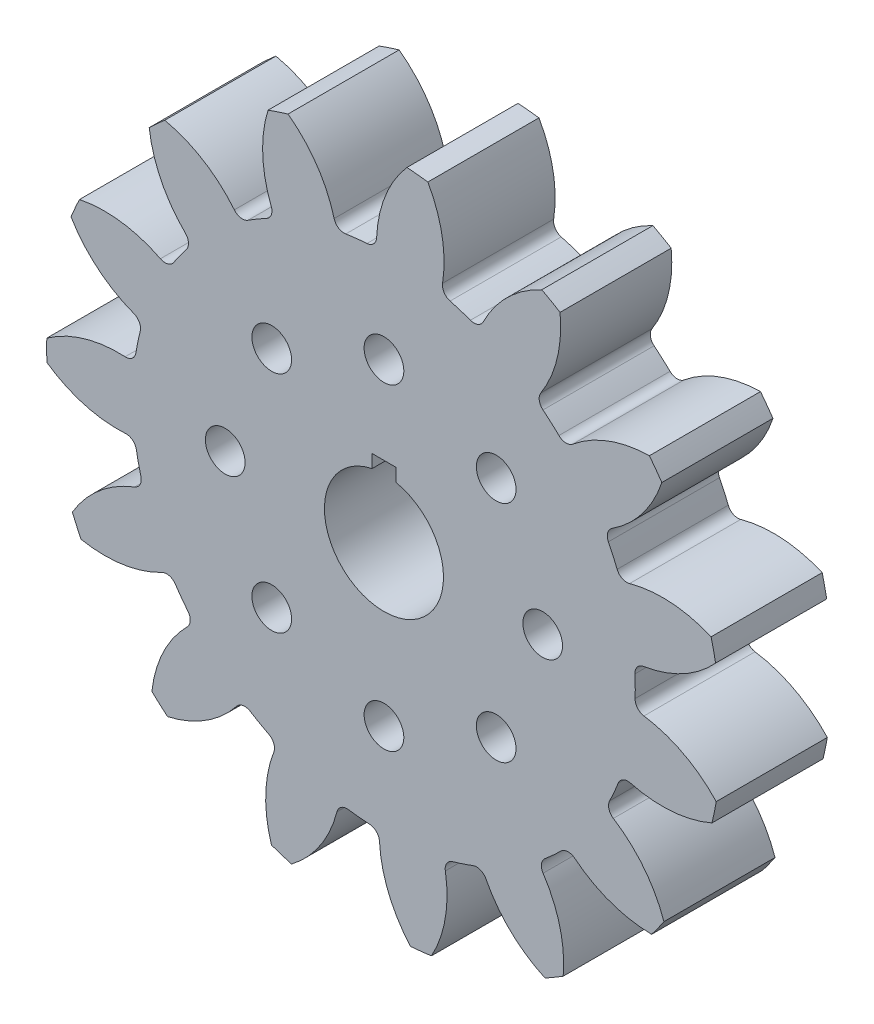
from build123d import *

# Parameters (mm, degrees)
SKETCH1_R           = 42.5
BOSS_EXTRUDE1_DEPTH = 14
CUT_EXTRUDE2_START  = -14
CUT_EXTRUDE2_DEPTH  = 14
CIRPATTERN1_COUNT   = 15
SKETCH3_R           = 25
CUT_EXTRUDE3_DEPTH  = 3
SKETCH4_R           = 7.5
CUT_EXTRUDE4_DEPTH  = 12
BOSS_EXTRUDE2_START = 3
SKETCH5_R           = 15
SKETCH5_R_2         = 7.5
BOSS_EXTRUDE2_DEPTH = 3
SKETCH6_R           = 2.5
CUT_EXTRUDE7_DEPTH  = 62.033988058
SKETCH7_W           = 3
SKETCH7_H           = 3
CUT_EXTRUDE8_DEPTH  = 62.645338009


with BuildPart() as part:
    # Sketch1 → Boss-Extrude1 (new body)
    with BuildSketch(Plane.XY):
        Circle(SKETCH1_R)
    extrude(amount=BOSS_EXTRUDE1_DEPTH)

    # Sketch2 → Cut-Extrude2 (cut)
    with BuildSketch(Plane.XY.offset(14).offset(CUT_EXTRUDE2_START)):
        with BuildLine():
            ThreePointArc((-2.144011648, 31.593985761), (-3.481811501, 31.474651879), (-4.813347736, 31.298696551))
            ThreePointArc((-4.813347736, 31.298696551), (-5.726736069, 31.495664334), (-6.276040886, 32.251533881))
            ThreePointArc((-6.276040886, 32.251533881), (-8.460316615, 36.991957647), (-12.087909655, 40.744722851))
            ThreePointArc((-12.087909655, 40.744722851), (-4.67296, 42.242318175), (2.890034901, 42.401623769))
            ThreePointArc((2.890034901, 42.401623769), (0.170397531, 37.946710693), (-0.924947108, 32.843486413))
            ThreePointArc((-0.924947108, 32.843486413), (-1.295759412, 31.98583101), (-2.144011648, 31.593985761))
        make_face()
    cut_extrude2 = extrude(amount=CUT_EXTRUDE2_DEPTH, mode=Mode.SUBTRACT)

    # CirPattern1: Cut-Extrude2 ×15 about axis
    cirpattern1_axis = Axis((0, 0, 0), (0, 0, 1))
    for i in range(1, CIRPATTERN1_COUNT):
        add(cut_extrude2.rotate(cirpattern1_axis, i * 360 / CIRPATTERN1_COUNT), mode=Mode.SUBTRACT)

    # Sketch3 → Cut-Extrude3 (cut)
    with BuildSketch(Plane(origin=(0, 0, 0), x_dir=(-1, 0, 0), z_dir=(0, 0, -1))):
        Circle(SKETCH3_R)
    extrude(amount=-CUT_EXTRUDE3_DEPTH, mode=Mode.SUBTRACT)

    # Sketch4 → Cut-Extrude4 (cut)
    with BuildSketch(Plane(origin=(0, 0, 3), x_dir=(-1, 0, 0), z_dir=(0, 0, -1))):
        Circle(SKETCH4_R)
    extrude(amount=-CUT_EXTRUDE4_DEPTH, mode=Mode.SUBTRACT)

    # Sketch5 → Boss-Extrude2 (add)
    with BuildSketch(Plane(origin=(0, 0, 3), x_dir=(-1, 0, 0), z_dir=(0, 0, -1)).offset(BOSS_EXTRUDE2_START)):
        Circle(SKETCH5_R)
        Circle(SKETCH5_R_2, mode=Mode.SUBTRACT)
    extrude(amount=-BOSS_EXTRUDE2_DEPTH)

    # Sketch6 → Cut-Extrude7 (cut, through all)
    with BuildSketch(Plane(origin=(0, 0, 3), x_dir=(-1, 0, 0), z_dir=(0, 0, -1))):
        with Locations((0, 20)):
            Circle(SKETCH6_R)
        with Locations((14.142135624, 14.142135624)):
            Circle(SKETCH6_R)
        with Locations((20, 0)):
            Circle(SKETCH6_R)
        with Locations((14.142135624, -14.142135624)):
            Circle(SKETCH6_R)
        with Locations((0, -20)):
            Circle(SKETCH6_R)
        with Locations((-14.142135624, -14.142135624)):
            Circle(SKETCH6_R)
        with Locations((-20, 0)):
            Circle(SKETCH6_R)
        with Locations((-14.142135624, 14.142135624)):
            Circle(SKETCH6_R)
    extrude(amount=-CUT_EXTRUDE7_DEPTH, mode=Mode.SUBTRACT)

    # Sketch7 → Cut-Extrude8 (cut, through all)
    with BuildSketch(Plane(origin=(0, 0, 0), x_dir=(-1, 0, 0), z_dir=(0, 0, -1))):
        with Locations((0, 7.5)):
            Rectangle(SKETCH7_W, SKETCH7_H)
    extrude(amount=-CUT_EXTRUDE8_DEPTH, mode=Mode.SUBTRACT)


solid = part.part
